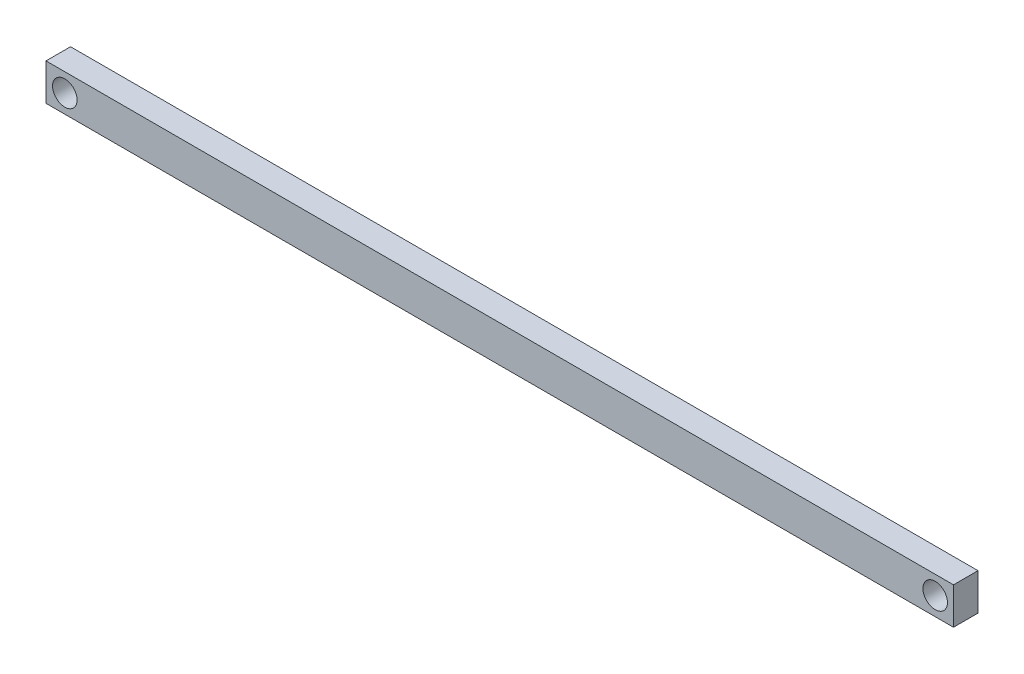
from build123d import *

# Parameters (mm, degrees)
SKETCH_1_W      = 370
SKETCH_1_H      = 15
SKETCH_1_R      = 5
EXTRUDE_1_DEPTH = 10


with BuildPart() as part:
    # 草图1 → 凸台-拉伸1 (new body)
    with BuildSketch(Plane.XY):
        with Locations((132.451805946, -1.490803966)):
            Rectangle(SKETCH_1_W, SKETCH_1_H)
        with Locations((-44.866730471, -1.490803966)):
            Circle(SKETCH_1_R, mode=Mode.SUBTRACT)
        with Locations((309.994324272, -1.490803966)):
            Circle(SKETCH_1_R, mode=Mode.SUBTRACT)
    extrude(amount=EXTRUDE_1_DEPTH)


solid = part.part
